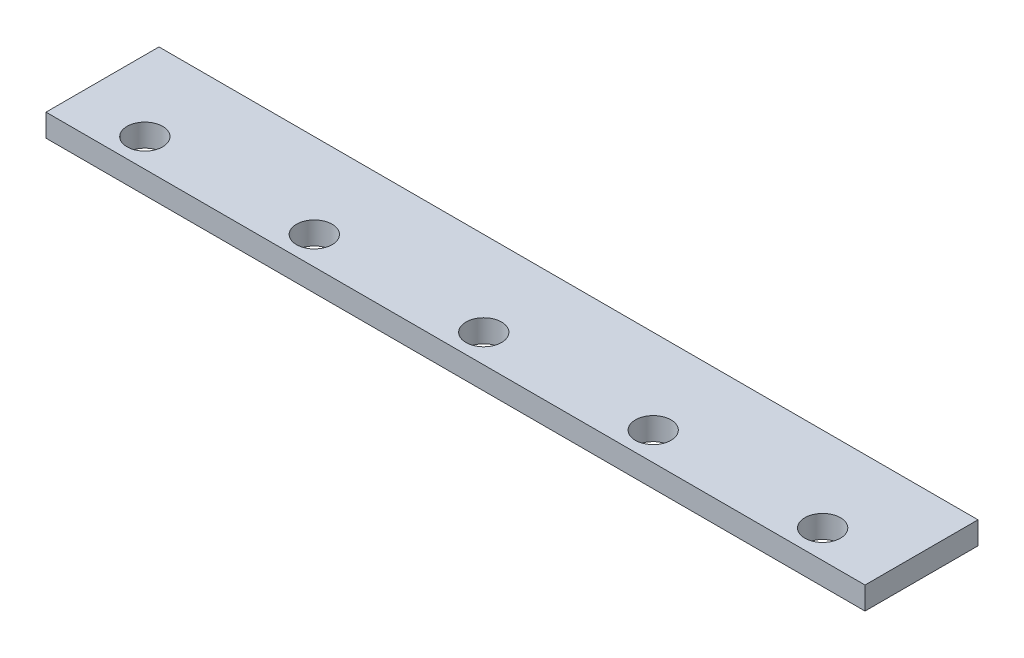
from build123d import *

# Parameters (mm, degrees)
SKETCH1_W           = 580
SKETCH1_H           = 80
SKETCH1_R           = 12.6
BOSS_EXTRUDE2_DEPTH = 16


with BuildPart() as part:
    # Sketch1 → Boss-Extrude2 (new body)
    with BuildSketch(Plane(origin=(0, 0, 0), x_dir=(1, 0, 0), z_dir=(0, 1, 0))):
        with Locations((290, 40)):
            Rectangle(SKETCH1_W, SKETCH1_H)
        with Locations(Location((50, 20, 0), (0, 0, 270))):
            Circle(SKETCH1_R, mode=Mode.SUBTRACT)
        with Locations(Location((530, 20, 0), (0, 0, 270))):
            Circle(SKETCH1_R, mode=Mode.SUBTRACT)
        with Locations(Location((410, 20, 0), (0, 0, 270))):
            Circle(SKETCH1_R, mode=Mode.SUBTRACT)
        with Locations(Location((290, 20, 0), (0, 0, 270))):
            Circle(SKETCH1_R, mode=Mode.SUBTRACT)
        with Locations(Location((170, 20, 0), (0, 0, 270))):
            Circle(SKETCH1_R, mode=Mode.SUBTRACT)
    extrude(amount=BOSS_EXTRUDE2_DEPTH)


solid = part.part
